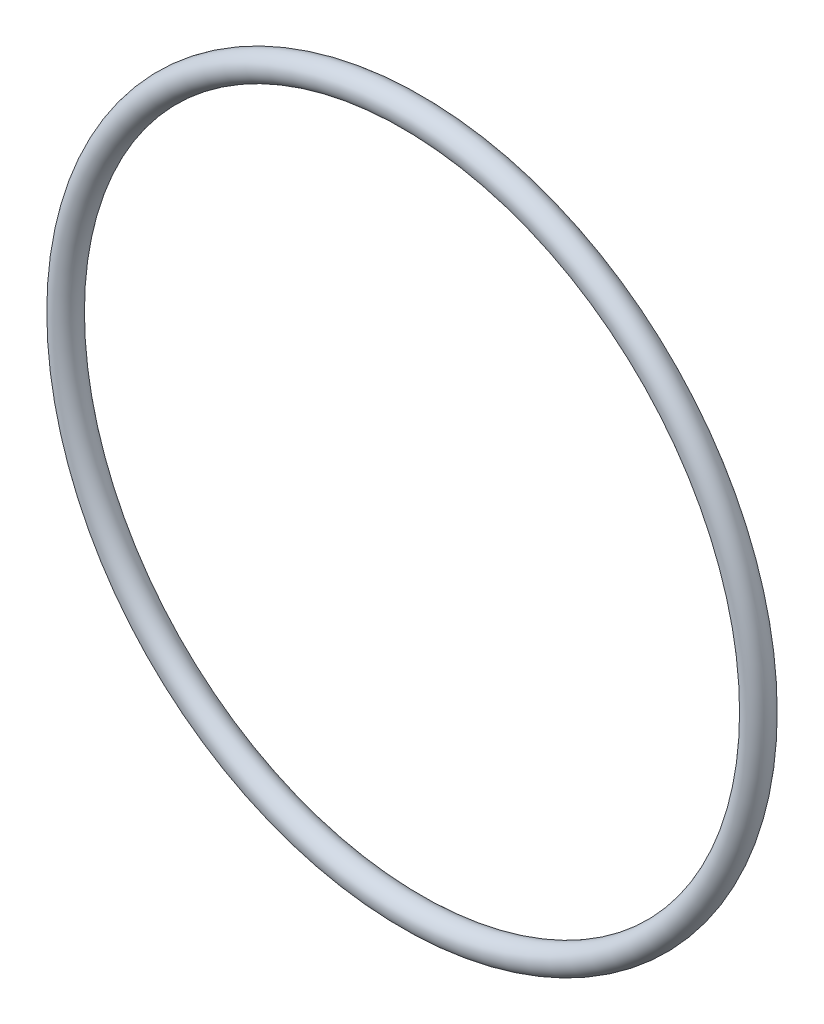
from build123d import *

# Parameters (mm, degrees)
SKETCH_2_R = 2.5


with BuildPart() as part:
    # 扫描1: sweep along a path in 草图1
    with BuildLine(Plane.XY) as sweep_1_path:
        CenterArc((0, 0), 65, 0, 360)
    # 草图2 → 扫描1 (sweep)
    with BuildSketch(Plane(origin=(0, 0, 0), x_dir=(1, 0, 0), z_dir=(0, 1, 0))):
        with Locations((-65, 0)):
            Circle(SKETCH_2_R)
    sweep(path=sweep_1_path.line)


solid = part.part
